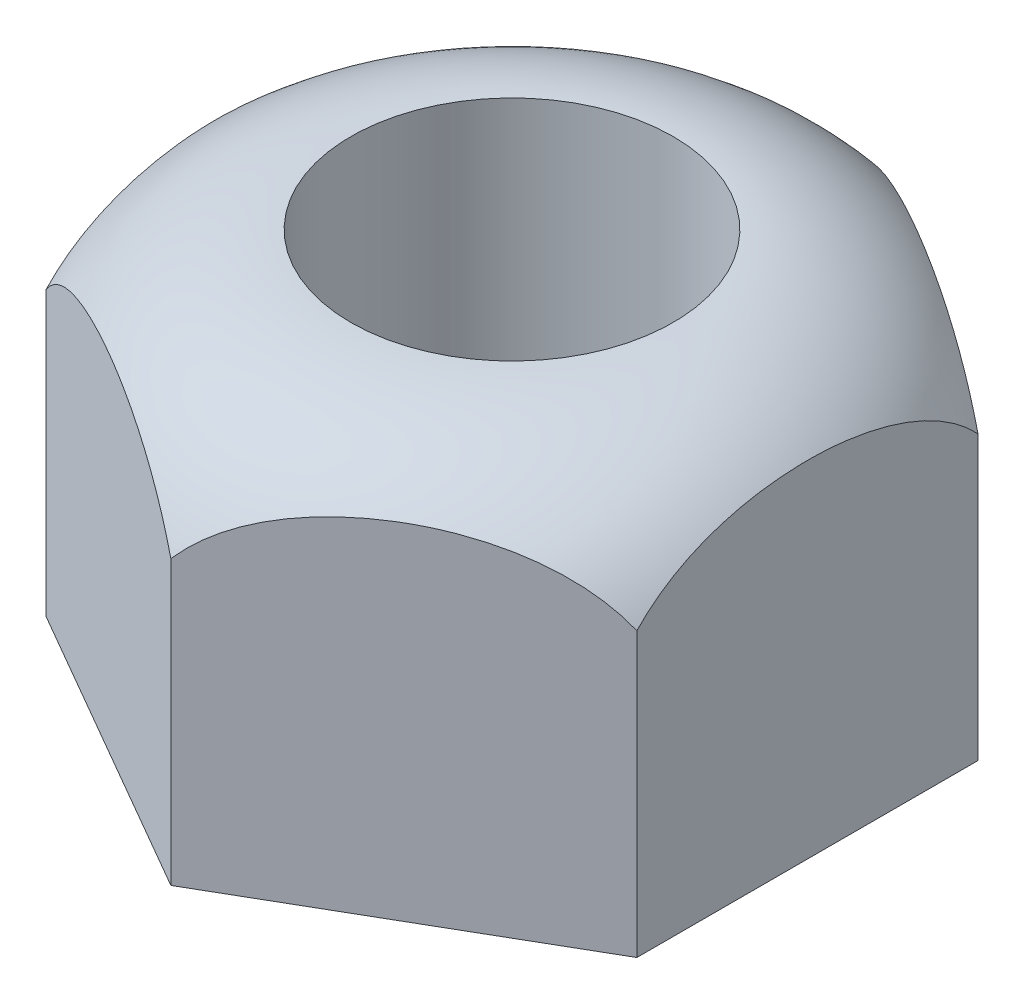
from build123d import *

# Parameters (mm, degrees)
SKETCH3_R           = 1.5
BOSS_EXTRUDE1_DEPTH = 1.85


with BuildPart() as part:
    # Sketch3 → Boss-Extrude1 (new, symmetric)
    with BuildSketch(Plane(origin=(0, 0, 0), x_dir=(1, 0, 0), z_dir=(0, 1, 0))):
        Polygon((2.75, 1.58771324), (0, 3.175426481), (-2.75, 1.58771324), (-2.75, -1.58771324), (0, -3.175426481), (2.75, -1.58771324), align=None)
        Circle(SKETCH3_R, mode=Mode.SUBTRACT)
    extrude(amount=BOSS_EXTRUDE1_DEPTH, both=True)

    # Sketch5 → Cut-Revolve1 (revolve, cut)
    with BuildSketch(Plane(origin=(0, 0, 0), x_dir=(0, 0, -1), z_dir=(1, 0, 0))):
        with BuildLine():
            Line((1.5, 1.85), (3.175426481, 1.85))
            Line((3.175426481, 1.85), (3.175426481, 0.784503734))
            ThreePointArc((3.175426481, 0.784503734), (2.492765857, 1.561062444), (1.5, 1.85))
        make_face()
    revolve(axis=Axis((0, 0, 0), (0, 1, 0)), mode=Mode.SUBTRACT)


solid = part.part
